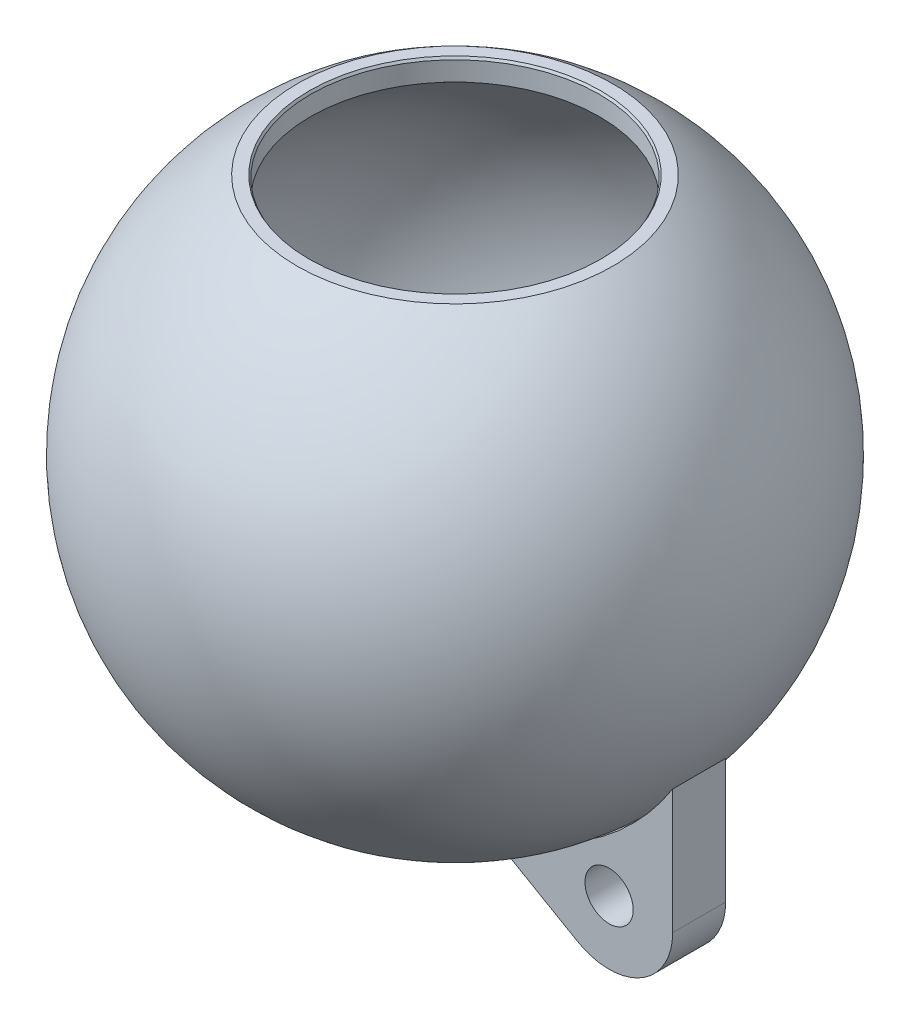
from build123d import *

# Parameters (mm, degrees)
SHELL1_T                   = 13.462
SKETCH2_R                  = 76.2
CUT_EXTRUDE1_DEPTH         = 152.4
BOSS_EXTRUDE1_DEPTH        = 13.97
BOSS_EXTRUDE1_DEPTH_BACK   = 13.97
SKETCH3_R                  = 12.7
BOSS_EXTRUDE1_2_DEPTH      = 13.97
BOSS_EXTRUDE1_2_DEPTH_BACK = 13.97
SKETCH4_R                  = 88.9
SKETCH4_R_2                = 76.2
CUT_EXTRUDE_THIN1_DEPTH    = 7.62
CHAMFER1_SIZE              = 1.27
CHAMFER1_SIZE2             = 0.733234842


with BuildPart() as part:
    # Sketch1 → Revolve3 (revolve)
    with BuildSketch(Plane(origin=(0, 0, 0), x_dir=(1, 0, 0), z_dir=(0, 1, 0))):
        with BuildLine():
            Line((0, -152.4), (0, 152.4))
            ThreePointArc((0, 152.4), (-152.4, 0), (0, -152.4))
        make_face()
    revolve(axis=Axis((0, 0, 152.4), (0, 0, -1)))

    # Shell1 (no face opened: a closed hollow body)
    add(offset(amount=-SHELL1_T, mode=Mode.PRIVATE), mode=Mode.SUBTRACT)

    # Sketch2 → Cut-Extrude1 (cut)
    with BuildSketch(Plane(origin=(0, 0, 0), x_dir=(1, 0, 0), z_dir=(0, 1, 0))):
        Circle(SKETCH2_R)
    extrude(amount=CUT_EXTRUDE1_DEPTH, mode=Mode.SUBTRACT)

    # Sketch4 → Cut-Extrude-Thin1 (cut)
    with BuildSketch(Plane(origin=(0, 127.608000689, 0), x_dir=(1, 0, 0), z_dir=(0, 1, 0))):
        Circle(SKETCH4_R)
        Circle(SKETCH4_R_2, mode=Mode.SUBTRACT)
    extrude(amount=CUT_EXTRUDE_THIN1_DEPTH, mode=Mode.SUBTRACT)

    # Chamfer1
    chamfer1_edges = [part.edges().sort_by_distance(p)[0] for p in [
        (-76.2, 127.608000689, 0),
    ]]
    chamfer1_side = [part.faces().sort_by_distance(p)[0] for p in [
        (-76.2, 121.893000689, 0),
    ]]
    chamfer(chamfer1_edges, length=CHAMFER1_SIZE, length2=CHAMFER1_SIZE2, reference=chamfer1_side[0])


with BuildPart() as body_2:
    # Sketch3 → Boss-Extrude1 (new, two sides: drawn at the far end of the back side and taken through both)
    with BuildSketch(Plane.XY.offset(-BOSS_EXTRUDE1_DEPTH_BACK)):
        with BuildLine():
            Line((-128.778, -81.498384745), (-128.778, -147.117317471))
            ThreePointArc((-128.778, -147.117317471), (-112.014, -176.15341721), (-78.486, -176.15341721))
            Line((-78.486, -176.15341721), (-31.605220987, -149.086786827))
            ThreePointArc((-31.605220987, -149.086786827), (-87.021505489, -125.112020136), (-128.778, -81.498384745))
        make_face()
        with Locations((-95.25, -147.117317471)):
            Circle(SKETCH3_R, mode=Mode.SUBTRACT)
    extrude(amount=BOSS_EXTRUDE1_DEPTH + BOSS_EXTRUDE1_DEPTH_BACK)


with BuildPart() as body_3:
    # Sketch3 → Boss-Extrude1 2 (new, two sides: drawn at the far end of the back side and taken through both)
    with BuildSketch(Plane.XY.offset(-BOSS_EXTRUDE1_2_DEPTH_BACK)):
        with BuildLine():
            Line((78.486, -176.15341721), (31.605220987, -149.086786827))
            ThreePointArc((31.605220987, -149.086786827), (87.021505489, -125.112020136), (128.778, -81.498384745))
            Line((128.778, -81.498384745), (128.778, -147.117317471))
            ThreePointArc((128.778, -147.117317471), (112.014, -176.15341721), (78.486, -176.15341721))
        make_face()
        with Locations((95.25, -147.117317471)):
            Circle(SKETCH3_R, mode=Mode.SUBTRACT)
    extrude(amount=BOSS_EXTRUDE1_2_DEPTH + BOSS_EXTRUDE1_2_DEPTH_BACK)


solid = Compound([part.part, body_2.part, body_3.part])
